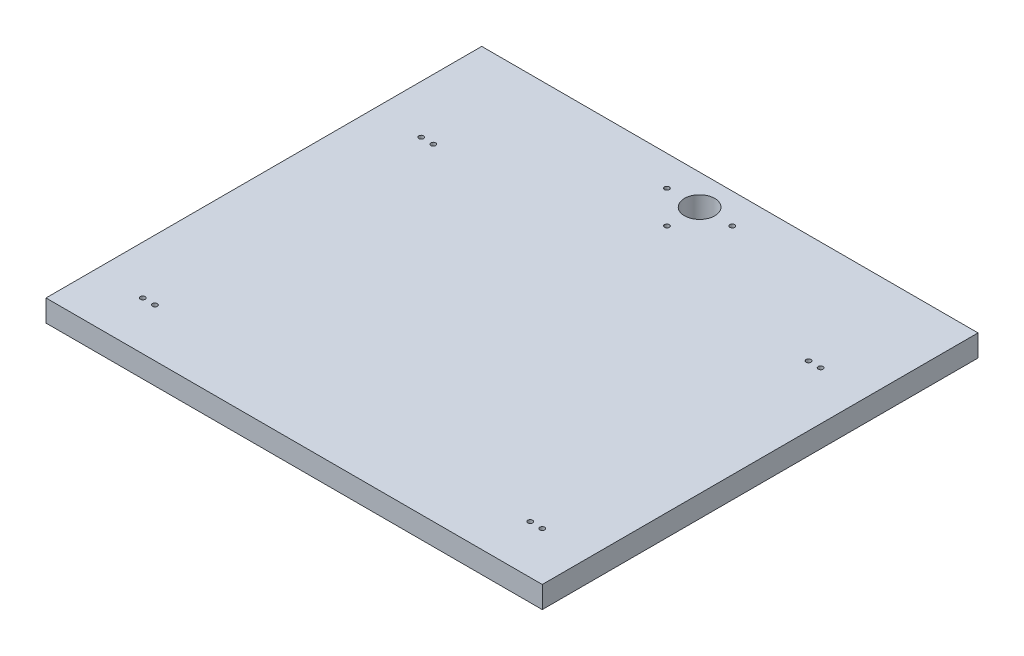
from build123d import *

# Parameters (mm, degrees)
SKETCH1_W                          = 410
SKETCH1_H                          = 360
BOSS_EXTRUDE1_DEPTH                = 18
SKETCH2_R                          = 12.5
CAMERA_STAND_TO_BASE_PROFILE_DEPTH = 546.915744415
SKETCH3_R                          = 2
CUT_EXTRUDE2_DEPTH                 = 546.915744415
SKETCH6_R                          = 2
CAMERA_STAND_TO_BASE_SCREW_DEPTH   = 546.915744415
SKETCH7_R                          = 4
CUT_EXTRUDE3_DEPTH                 = 8


with BuildPart() as part:
    # Sketch1 → Boss-Extrude1 (new body)
    with BuildSketch(Plane(origin=(0, 0, 0), x_dir=(1, 0, 0), z_dir=(0, 1, 0))):
        with Locations((205, 180)):
            Rectangle(SKETCH1_W, SKETCH1_H)
    extrude(amount=BOSS_EXTRUDE1_DEPTH)

    # Sketch2 → Camera Stand to Base (Profile) (cut, through all)
    with BuildSketch(Plane(origin=(0, 18, 0), x_dir=(1, 0, 0), z_dir=(0, 1, 0))):
        with Locations(Location((205, 335, 0), (0, 0, 270))):
            Circle(SKETCH2_R)
    extrude(amount=-CAMERA_STAND_TO_BASE_PROFILE_DEPTH, mode=Mode.SUBTRACT)

    # Sketch3 → Cut-Extrude2 (cut, through all)
    with BuildSketch(Plane(origin=(0, 18, 0), x_dir=(1, 0, 0), z_dir=(0, 1, 0))):
        with Locations(Location((40, 40, 0), (0, 0, 270))):
            Circle(SKETCH3_R)
        with Locations(Location((50, 40, 0), (0, 0, 270))):
            Circle(SKETCH3_R)
        with Locations(Location((360, 40, 0), (0, 0, 270))):
            Circle(SKETCH3_R)
        with Locations(Location((370, 40, 0), (0, 0, 270))):
            Circle(SKETCH3_R)
        with Locations(Location((370, 270, 0), (0, 0, 270))):
            Circle(SKETCH3_R)
        with Locations(Location((360, 270, 0), (0, 0, 270))):
            Circle(SKETCH3_R)
        with Locations(Location((40, 270, 0), (0, 0, 270))):
            Circle(SKETCH3_R)
        with Locations(Location((50, 270, 0), (0, 0, 270))):
            Circle(SKETCH3_R)
    extrude(amount=-CUT_EXTRUDE2_DEPTH, mode=Mode.SUBTRACT)

    # Sketch6 → Camera Stand to Base (Screw) (cut, through all)
    with BuildSketch(Plane.XZ):
        with Locations(Location((205, -308, 0), (0, 0, 270))):
            Circle(SKETCH6_R)
        with Locations(Location((178, -335, 0), (0, 0, 270))):
            Circle(SKETCH6_R)
        with Locations(Location((232, -335, 0), (0, 0, 270))):
            Circle(SKETCH6_R)
    extrude(amount=-CAMERA_STAND_TO_BASE_SCREW_DEPTH, mode=Mode.SUBTRACT)

    # Sketch7 → Cut-Extrude3 (cut)
    with BuildSketch(Plane.XZ):
        with Locations(Location((40, -40, 0), (0, 0, 270))):
            Circle(SKETCH7_R)
        with Locations(Location((50, -40, 0), (0, 0, 270))):
            Circle(SKETCH7_R)
        with Locations(Location((360, -40, 0), (0, 0, 270))):
            Circle(SKETCH7_R)
        with Locations(Location((370, -40, 0), (0, 0, 270))):
            Circle(SKETCH7_R)
        with Locations(Location((370, -270, 0), (0, 0, 270))):
            Circle(SKETCH7_R)
        with Locations(Location((360, -270, 0), (0, 0, 270))):
            Circle(SKETCH7_R)
        with Locations(Location((50, -270, 0), (0, 0, 270))):
            Circle(SKETCH7_R)
        with Locations(Location((40, -270, 0), (0, 0, 270))):
            Circle(SKETCH7_R)
        with Locations(Location((178, -335, 0), (0, 0, 270))):
            Circle(SKETCH7_R)
        with Locations(Location((205, -308, 0), (0, 0, 270))):
            Circle(SKETCH7_R)
        with Locations(Location((232, -335, 0), (0, 0, 270))):
            Circle(SKETCH7_R)
    extrude(amount=-CUT_EXTRUDE3_DEPTH, mode=Mode.SUBTRACT)


solid = part.part
